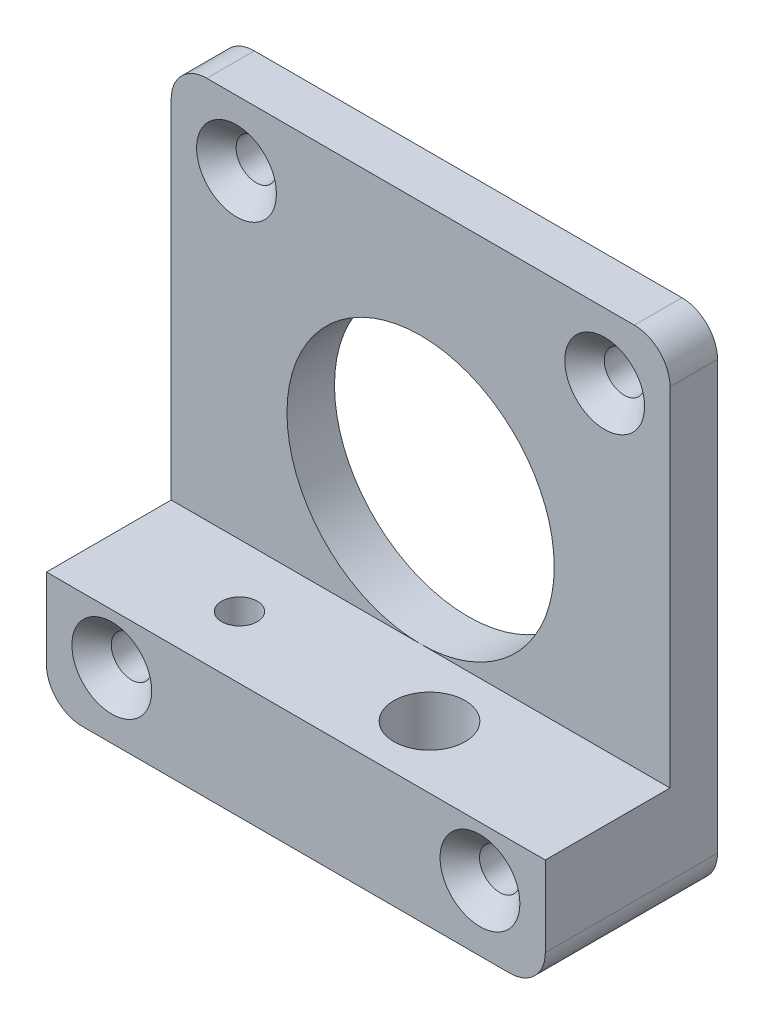
from build123d import *

# Parameters (mm, degrees)
CROQUIS1_R                                           = 1
CROQUIS1_R_2                                         = 11.25
SALIENTE_EXTRUIR1_DEPTH                              = 4
CROQUIS2_R                                           = 1
SALIENTE_EXTRUIR2_DEPTH                              = 10.5
CROQUIS3_R                                           = 3
CROQUIS3_R_2                                         = 1.5
CORTAR_EXTRUIR1_DEPTH                                = 9.75
REFRENTADO_PARA_TORNILLO_TAP_N_CON_CABEZ_D           = 3.4
REFRENTADO_PARA_TORNILLO_TAP_N_CON_CABEZ_CSINK_D     = 6.72
REFRENTADO_PARA_TORNILLO_TAP_N_CON_CABEZ_CSINK_ANGLE = 90
REFRENTADO_PARA_TORNILLO_TAP_N_CON_C_2_D             = 3.4
REFRENTADO_PARA_TORNILLO_TAP_N_CON_C_2_CSINK_D       = 6.72
REFRENTADO_PARA_TORNILLO_TAP_N_CON_C_2_CSINK_ANGLE   = 90


with BuildPart() as part:
    # Croquis1 → Saliente-Extruir1 (new body)
    with BuildSketch(Plane.XY):
        with BuildLine():
            Line((-18, 21), (18, 21))
            ThreePointArc((18, 21), (20.121320344, 20.121320344), (21, 18))
            Line((21, 18), (21, -18))
            ThreePointArc((21, -18), (20.121320344, -20.121320344), (18, -21))
            Line((18, -21), (-18, -21))
            ThreePointArc((-18, -21), (-20.121320344, -20.121320344), (-21, -18))
            Line((-21, -18), (-21, 18))
            ThreePointArc((-21, 18), (-20.121320344, 20.121320344), (-18, 21))
        make_face()
        with Locations((-15.5, 15.5)):
            Circle(CROQUIS1_R, mode=Mode.SUBTRACT)
        with Locations((15.5, 15.5)):
            Circle(CROQUIS1_R, mode=Mode.SUBTRACT)
        with Locations((15.5, -15.5)):
            Circle(CROQUIS1_R, mode=Mode.SUBTRACT)
        with Locations((-15.5, -15.5)):
            Circle(CROQUIS1_R, mode=Mode.SUBTRACT)
        Circle(CROQUIS1_R_2, mode=Mode.SUBTRACT)
    extrude(amount=SALIENTE_EXTRUIR1_DEPTH)

    # Croquis2 → Saliente-Extruir2 (add)
    with BuildSketch(Plane.XY.offset(4)):
        with BuildLine():
            Line((-21, -11.25), (21, -11.25))
            Line((21, -11.25), (21, -18))
            ThreePointArc((21, -18), (20.121320344, -20.121320344), (18, -21))
            Line((18, -21), (-18, -21))
            ThreePointArc((-18, -21), (-20.121320344, -20.121320344), (-21, -18))
            Line((-21, -18), (-21, -11.25))
        make_face()
        with Locations((15.5, -15.5)):
            Circle(CROQUIS2_R, mode=Mode.SUBTRACT)
        with Locations((-15.5, -15.5)):
            Circle(CROQUIS2_R, mode=Mode.SUBTRACT)
    extrude(amount=SALIENTE_EXTRUIR2_DEPTH)

    # Croquis3 → Cortar-Extruir1 (cut)
    with BuildSketch(Plane(origin=(0, -11.25, 0), x_dir=(1, 0, 0), z_dir=(0, 1, 0))):
        with Locations(Location((6, -9.25, 0), (0, 0, 180))):
            Circle(CROQUIS3_R)
        with Locations(Location((-10, -9.25, 0), (0, 0, 180))):
            Circle(CROQUIS3_R_2)
    extrude(amount=-CORTAR_EXTRUIR1_DEPTH, mode=Mode.SUBTRACT)

    # Refrentado para tornillo tap_n con cabez (through all)
    with Locations(Plane.XY.offset(4)):
        with Locations((-15.5, 15.5), (15.5, 15.5)):
            CounterSinkHole(REFRENTADO_PARA_TORNILLO_TAP_N_CON_CABEZ_D / 2, REFRENTADO_PARA_TORNILLO_TAP_N_CON_CABEZ_CSINK_D / 2, counter_sink_angle=REFRENTADO_PARA_TORNILLO_TAP_N_CON_CABEZ_CSINK_ANGLE)

    # Refrentado para tornillo tap_n con c 2 (through all)
    with Locations(Plane.XY.offset(14.5)):
        with Locations((-15.5, -15.5), (15.5, -15.5)):
            CounterSinkHole(REFRENTADO_PARA_TORNILLO_TAP_N_CON_C_2_D / 2, REFRENTADO_PARA_TORNILLO_TAP_N_CON_C_2_CSINK_D / 2, counter_sink_angle=REFRENTADO_PARA_TORNILLO_TAP_N_CON_C_2_CSINK_ANGLE)


solid = part.part
